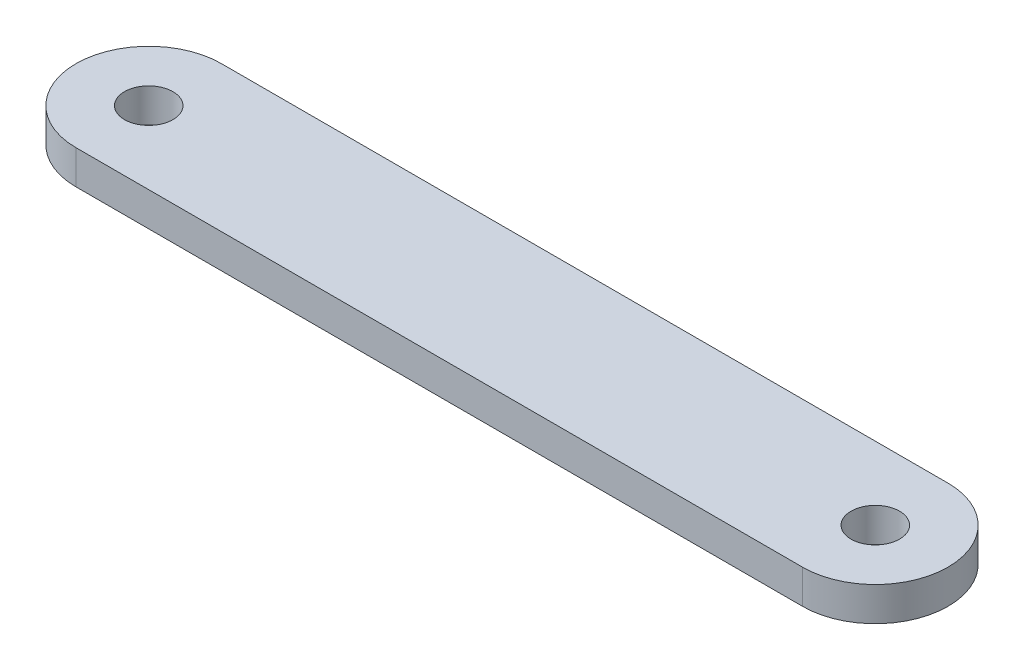
from build123d import *

# Parameters (mm, degrees)
SKETCH_1_R      = 5
EXTRUDE_1_DEPTH = 7


with BuildPart() as part:
    # Эскиз1 → Вытянуть1 (new body)
    with BuildSketch(Plane(origin=(0, 0, 0), x_dir=(1, 0, 0), z_dir=(0, 1, 0))):
        with BuildLine():
            Line((0, 15), (149.801569261, 15))
            ThreePointArc((149.801569261, 15), (164.801569261, 0), (149.801569261, -15))
            Line((149.801569261, -15), (0, -15))
            ThreePointArc((0, -15), (-15, 0), (0, 15))
        make_face()
        with Locations(Location((0, 0, 0), (0, 0, 270))):
            Circle(SKETCH_1_R, mode=Mode.SUBTRACT)
        with Locations(Location((149.801569261, 0, 0), (0, 0, 270))):
            Circle(SKETCH_1_R, mode=Mode.SUBTRACT)
    extrude(amount=EXTRUDE_1_DEPTH)


solid = part.part
